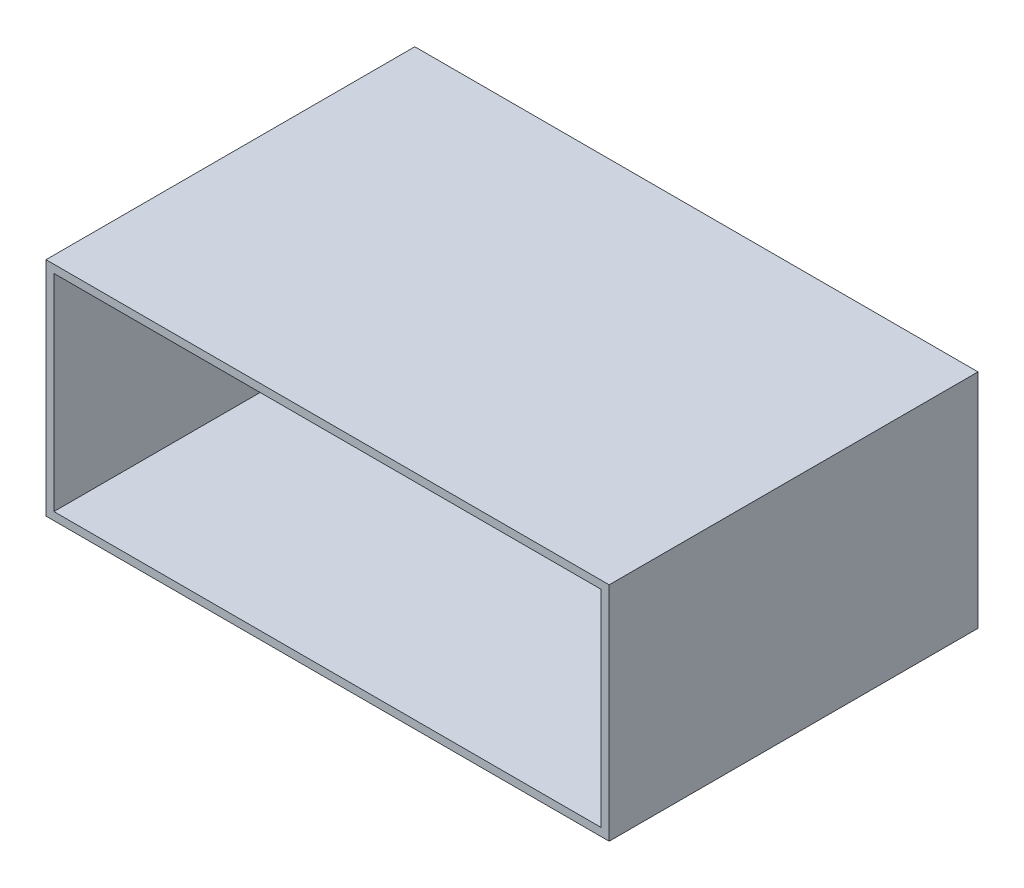
from build123d import *

# Parameters (mm, degrees)
SKETCH1_W     = 142
SKETCH1_H     = 56
SKETCH1_W_2   = 138
SKETCH1_H_2   = 52
PROFILE_DEPTH = 93
SKETCH2_W     = 138
SKETCH2_H     = 52
BACK_DEPTH    = 2


with BuildPart() as part:
    # Sketch1 → Profile (new body)
    with BuildSketch(Plane.XY):
        with Locations((71, 28)):
            Rectangle(SKETCH1_W, SKETCH1_H)
        with Locations((71, 28)):
            Rectangle(SKETCH1_W_2, SKETCH1_H_2, mode=Mode.SUBTRACT)
    extrude(amount=PROFILE_DEPTH)

    # Sketch2 → Back (add)
    with BuildSketch(Plane.XY):
        with Locations((71, 28)):
            Rectangle(SKETCH2_W, SKETCH2_H)
    extrude(amount=BACK_DEPTH)


solid = part.part
